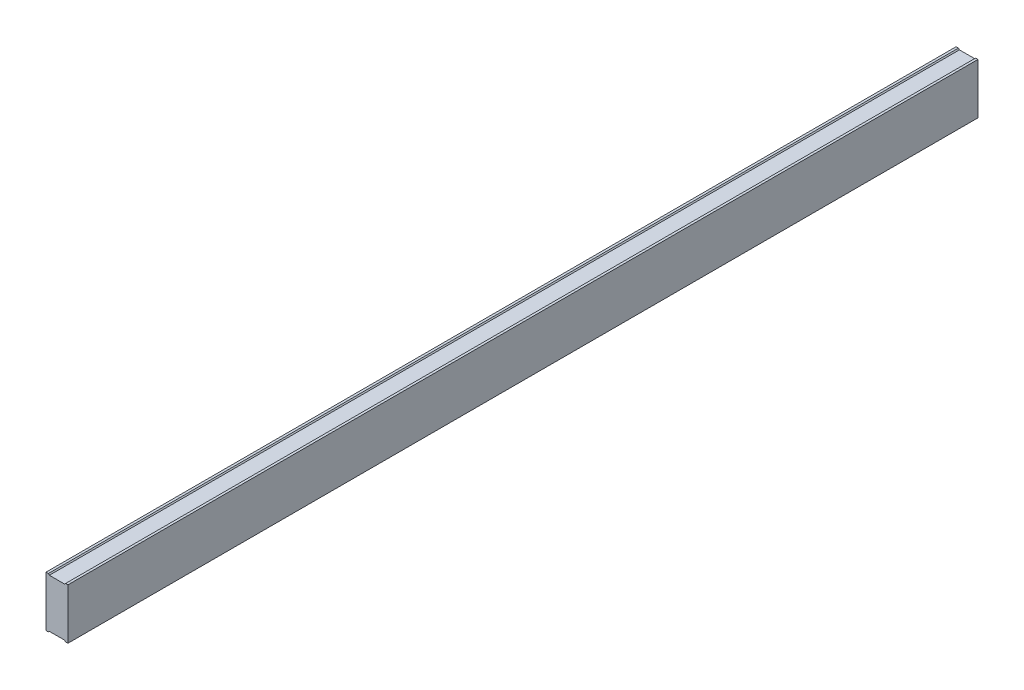
from build123d import *

# Parameters (mm, degrees)
EXTRUDE_1_DEPTH = 2697
SKETCH_2_W      = 61
SKETCH_2_H      = 134
EXTRUDE_2_DEPTH = 6
SKETCH_3_W      = 61
SKETCH_3_H      = 134
EXTRUDE_3_DEPTH = 6


with BuildPart() as part:
    # Model → 凸台-拉伸1 (new body)
    with BuildSketch(Plane.XY):
        with BuildLine():
            Line((11739.240027423, -58278.413223948), (11736.240027423, -58275.413223948))
            Line((11736.240027423, -58275.413223948), (11691.240027423, -58275.413223948))
            Line((11691.240027423, -58275.413223948), (11688.240027423, -58278.413223948))
            Line((11688.240027423, -58278.413223948), (11681.240027423, -58278.413223948))
            Line((11681.240027423, -58278.413223948), (11681.240027423, -58270.413223948))
            Line((11681.240027423, -58270.413223948), (11739.240027423, -58270.413223948))
            ThreePointArc((11739.240027423, -58270.413223948), (11741.361347766, -58269.534544291), (11742.240027423, -58267.413223948))
            Line((11742.240027423, -58267.413223948), (11742.240027423, -58139.413223948))
            ThreePointArc((11742.240027423, -58139.413223948), (11741.361347766, -58137.291903604), (11739.240027423, -58136.413223948))
            Line((11739.240027423, -58136.413223948), (11681.240027423, -58136.413223948))
            Line((11681.240027423, -58136.413223948), (11681.240027423, -58128.413223948))
            Line((11681.240027423, -58128.413223948), (11688.240027423, -58128.413223948))
            Line((11688.240027423, -58128.413223948), (11691.240027423, -58131.413223948))
            Line((11691.240027423, -58131.413223948), (11736.240027423, -58131.413223948))
            Line((11736.240027423, -58131.413223948), (11739.240027423, -58128.413223948))
            Line((11739.240027423, -58128.413223948), (11746.240027423, -58128.413223948))
            Line((11746.240027423, -58128.413223948), (11746.240027423, -58278.413223948))
            Line((11746.240027423, -58278.413223948), (11739.240027423, -58278.413223948))
        make_face()
    extrude(amount=EXTRUDE_1_DEPTH)

    # 草图2 → 凸台-拉伸2 (add)
    with BuildSketch(Plane.XY.offset(2697)):
        with Locations((11711.740027423, -58203.413223948)):
            Rectangle(SKETCH_2_W, SKETCH_2_H)
    extrude(amount=-EXTRUDE_2_DEPTH)

    # 草图3 → 凸台-拉伸3 (add)
    with BuildSketch(Plane(origin=(0, 0, 0), x_dir=(-1, 0, 0), z_dir=(0, 0, -1))):
        with Locations((-11711.740027423, -58203.413223948)):
            Rectangle(SKETCH_3_W, SKETCH_3_H)
    extrude(amount=-EXTRUDE_3_DEPTH)


solid = part.part
